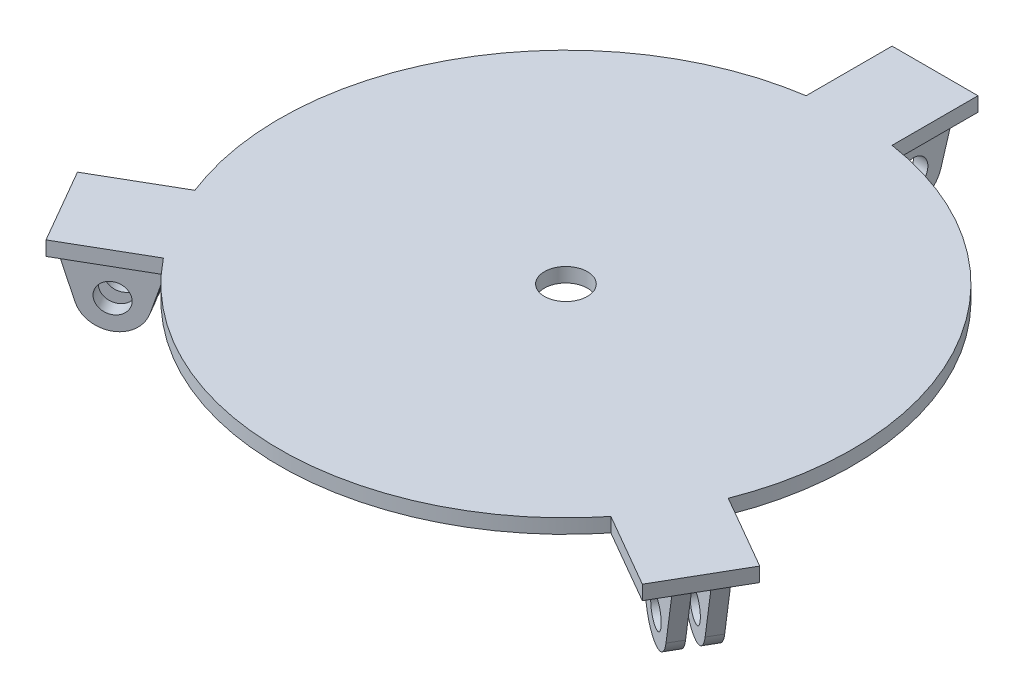
from build123d import *

# Parameters (mm, degrees)
SKETCH1_R           = 7.5
BOSS_EXTRUDE2_DEPTH = 5
BOSS_EXTRUDE5_START = 2.5
SKETCH4_R           = 5
BOSS_EXTRUDE5_DEPTH = 5
BOSS_EXTRUDE6_START = -7.5
SKETCH4_2_R         = 5
BOSS_EXTRUDE6_DEPTH = 5
CIRPATTERN5_COUNT   = 3
CIRPATTERN5_ANGLE   = 240


with BuildPart() as part:
    # Sketch1 → Boss-Extrude2 (new body)
    with BuildSketch(Plane(origin=(0, 0, 0), x_dir=(1, 0, 0), z_dir=(0, 1, 0))):
        with BuildLine():
            Line((-15, 128.868599666), (-15, 98.868599666))
            ThreePointArc((-15, 98.868599666), (-86.602540378, 50), (-93.122718948, -36.443918776))
            Line((-93.122718948, -36.443918776), (-119.103481061, -51.443918776))
            Line((-119.103481061, -51.443918776), (-104.103481061, -77.42468089))
            Line((-104.103481061, -77.42468089), (-78.122718948, -62.42468089))
            ThreePointArc((-78.122718948, -62.42468089), (0, -100), (78.122718948, -62.42468089))
            Line((78.122718948, -62.42468089), (104.103481061, -77.42468089))
            Line((104.103481061, -77.42468089), (119.103481061, -51.443918776))
            Line((119.103481061, -51.443918776), (93.122718948, -36.443918776))
            ThreePointArc((93.122718948, -36.443918776), (86.602540378, 50), (15, 98.868599666))
            Line((15, 98.868599666), (15, 128.868599666))
            Line((15, 128.868599666), (-15, 128.868599666))
        make_face()
        Circle(SKETCH1_R, mode=Mode.SUBTRACT)
    extrude(amount=BOSS_EXTRUDE2_DEPTH)

    # Sketch4 → Boss-Extrude5 (add)
    with BuildSketch(Plane(origin=(0, 0, 0), x_dir=(0, 0, -1), z_dir=(1, 0, 0)).offset(BOSS_EXTRUDE5_START)):
        with BuildLine():
            Line((104.299170688, -17.902762311), (98.868599666, 0))
            Line((98.868599666, 0), (128.868599666, 0))
            Line((128.868599666, 0), (123.438028644, -17.902762311))
            ThreePointArc((123.438028644, -17.902762311), (113.868599666, -25), (104.299170688, -17.902762311))
        make_face()
        with Locations((113.868599666, -15)):
            Circle(SKETCH4_R, mode=Mode.SUBTRACT)
    boss_extrude5 = extrude(amount=BOSS_EXTRUDE5_DEPTH)

    # Sketch4<2> → Boss-Extrude6 (add)
    with BuildSketch(Plane(origin=(0, 0, 0), x_dir=(0, 0, -1), z_dir=(1, 0, 0)).offset(BOSS_EXTRUDE6_START)):
        with BuildLine():
            Line((104.299170688, -17.902762311), (98.868599666, 0))
            Line((98.868599666, 0), (128.868599666, 0))
            Line((128.868599666, 0), (123.438028644, -17.902762311))
            ThreePointArc((123.438028644, -17.902762311), (113.868599666, -25), (104.299170688, -17.902762311))
        make_face()
        with Locations((113.868599666, -15)):
            Circle(SKETCH4_2_R, mode=Mode.SUBTRACT)
    boss_extrude6 = extrude(amount=BOSS_EXTRUDE6_DEPTH)

    # CirPattern5: Boss-Extrude5, Boss-Extrude6 ×3 about axis
    cirpattern5_axis = Axis((0, 0, 0), (0, 1, 0))
    add([boss_extrude5.rotate(cirpattern5_axis, i * CIRPATTERN5_ANGLE / (CIRPATTERN5_COUNT - 1)) for i in range(1, CIRPATTERN5_COUNT)])
    add([boss_extrude6.rotate(cirpattern5_axis, i * CIRPATTERN5_ANGLE / (CIRPATTERN5_COUNT - 1)) for i in range(1, CIRPATTERN5_COUNT)])


solid = part.part
